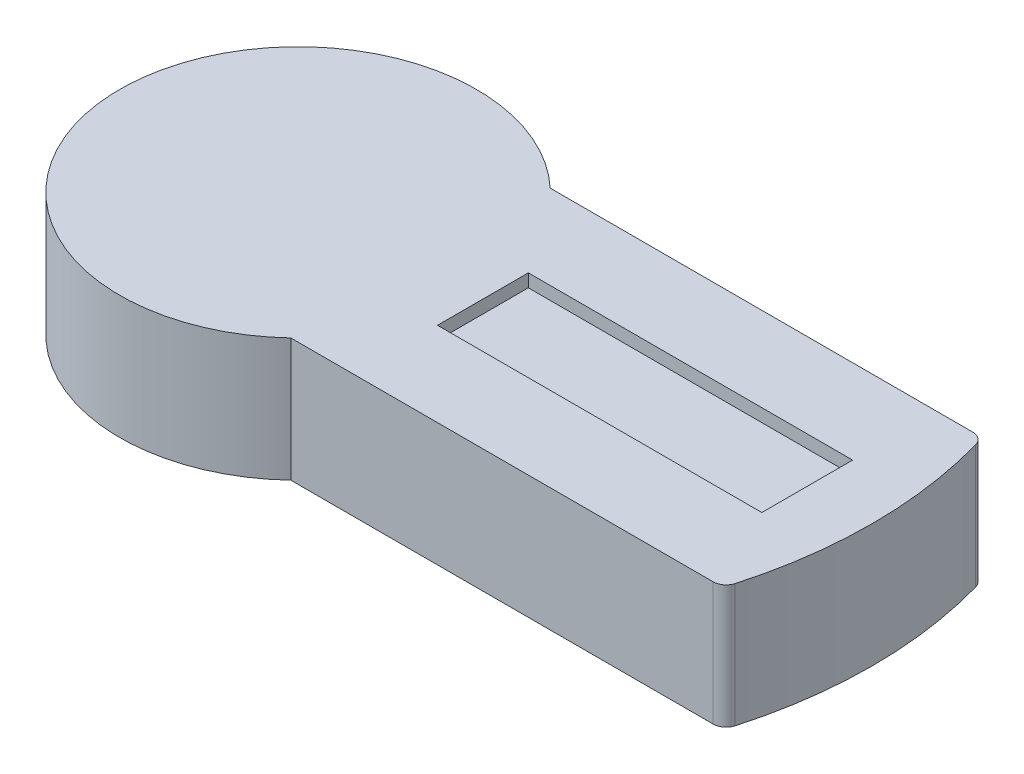
from build123d import *

# Parameters (mm, degrees)
SKETCH1_R                = 13.75
BOSS_EXTRUDE1_DEPTH      = 9.5
SKETCH2_W                = 44.25
SKETCH2_H                = 20
BOSS_EXTRUDE2_DEPTH      = 9.5
BOSS_EXTRUDE3_REACH      = 49.301
BOSS_EXTRUDE3_END_RADIUS = 16.25
SKETCH3_R                = 2
SKETCH4_W                = 25
SKETCH4_H                = 7
CUT_EXTRUDE1_DEPTH       = 1
CUT_EXTRUDE2_DEPTH       = 48.300898561
FILLET1_R                = 1


with BuildPart() as part:
    # Sketch1 → Boss-Extrude1 (new body)
    with BuildSketch(Plane(origin=(0, 0, 0), x_dir=(1, 0, 0), z_dir=(0, 1, 0))):
        with Locations(Location((0, 0, 0), (0, 0, 270))):
            Circle(SKETCH1_R)
    extrude(amount=BOSS_EXTRUDE1_DEPTH)

    # Sketch2 → Boss-Extrude2 (add)
    with BuildSketch(Plane(origin=(0, 0, 0), x_dir=(1, 0, 0), z_dir=(0, 1, 0))):
        with Locations((22.125, 0)):
            Rectangle(SKETCH2_W, SKETCH2_H)
    extrude(amount=BOSS_EXTRUDE2_DEPTH)

    # Boss-Extrude3: up to this cylinder (the profile starts inside it)
    boss_extrude3_end = Plane(origin=(0, 4.5, 0), z_dir=(0, -1, 0)) * Cylinder(BOSS_EXTRUDE3_END_RADIUS, 132.102, mode=Mode.PRIVATE)
    # Sketch3 → Boss-Extrude3 (add, up to the surface)
    with BuildSketch(Plane(origin=(0, 0, 0), x_dir=(0, 0, -1), z_dir=(1, 0, 0)), mode=Mode.PRIVATE) as boss_extrude3_sk1:
        with Locations((0, 4.5)):
            Circle(SKETCH3_R)
    boss_extrude3_tool1 = extrude(boss_extrude3_sk1.sketch, amount=-BOSS_EXTRUDE3_REACH, mode=Mode.PRIVATE) & boss_extrude3_end
    add(boss_extrude3_tool1.solids().sort_by_distance((0, 4.5, 0))[0])

    # Sketch4 → Cut-Extrude1 (cut)
    with BuildSketch(Plane(origin=(0, 9.5, 0), x_dir=(1, 0, 0), z_dir=(0, 1, 0))):
        with Locations((26.75, 0)):
            Rectangle(SKETCH4_W, SKETCH4_H)
    extrude(amount=-CUT_EXTRUDE1_DEPTH, mode=Mode.SUBTRACT)

    # Sketch5 → Cut-Extrude2 (cut, through all)
    with BuildSketch(Plane(origin=(0, 9.5, 0), x_dir=(1, 0, 0), z_dir=(0, 1, 0))):
        with BuildLine():
            Line((42.75, 10), (47.75, 10))
            Line((47.75, 10), (47.75, -10))
            Line((47.75, -10), (42.75, -10))
            ThreePointArc((42.75, -10), (44.25, 0), (42.75, 10))
        make_face()
    extrude(amount=-CUT_EXTRUDE2_DEPTH, mode=Mode.SUBTRACT)

    # Fillet1
    fillet1_edges = [part.edges().sort_by_distance(p)[0] for p in [
        (42.75, 4.75, 10),
        (42.75, 4.75, -10),
    ]]
    fillet(fillet1_edges, radius=FILLET1_R)


solid = part.part
